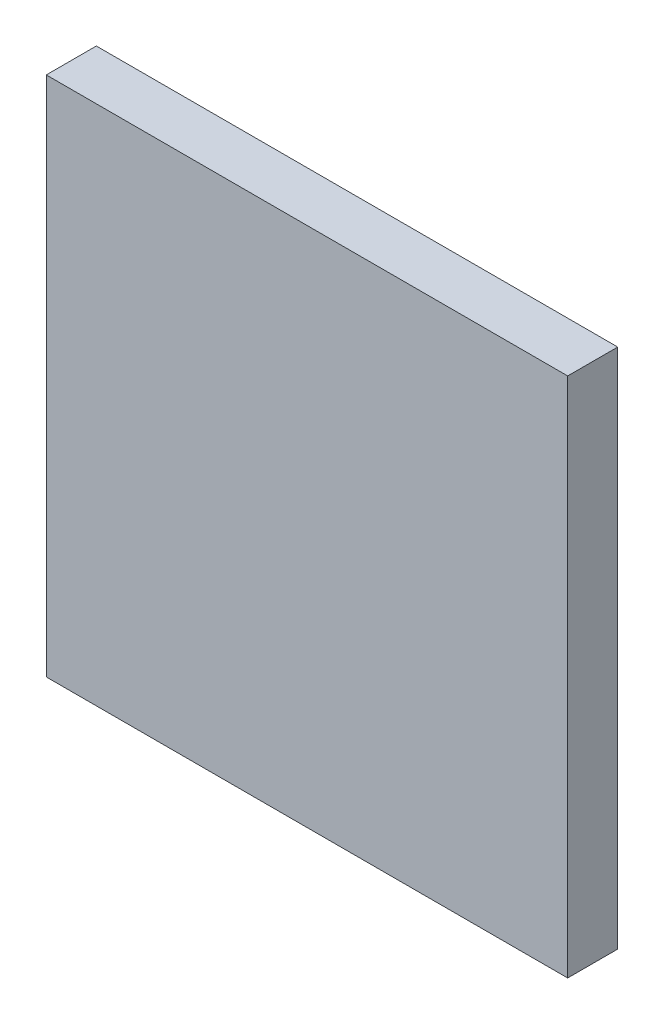
from build123d import *

# Parameters (mm, degrees)
SKETCH1_W           = 50
SKETCH1_H           = 50
BOSS_EXTRUDE1_DEPTH = 4.8


with BuildPart() as part:
    # Sketch1 → Boss-Extrude1 (new body)
    with BuildSketch(Plane.XY):
        with Locations((25, 25)):
            Rectangle(SKETCH1_W, SKETCH1_H)
    extrude(amount=BOSS_EXTRUDE1_DEPTH)


solid = part.part
